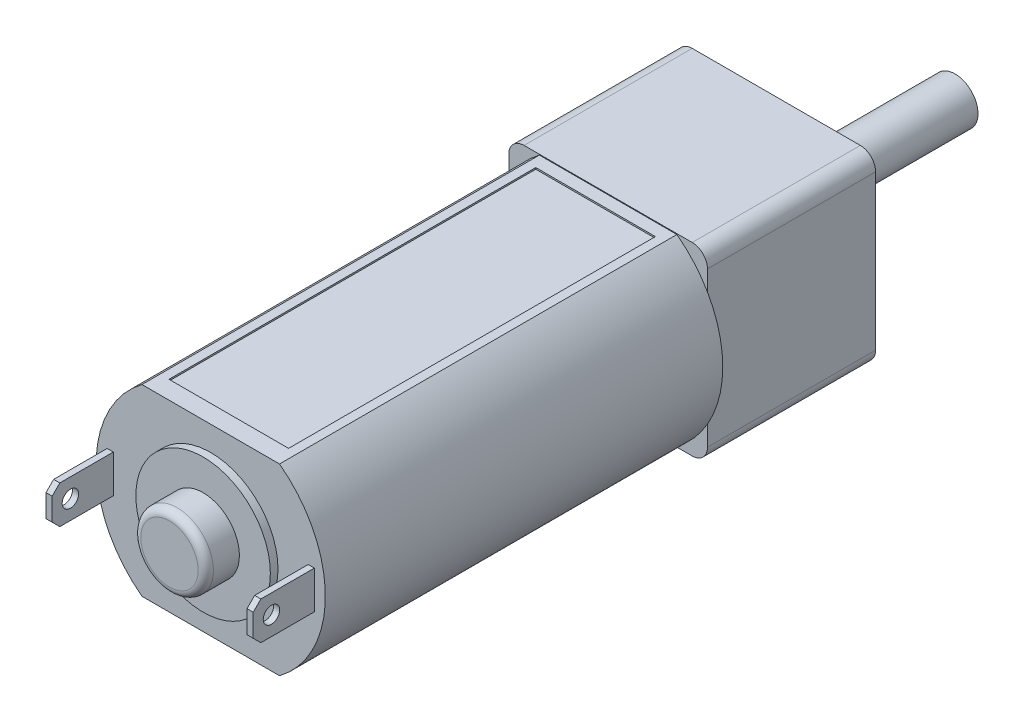
from build123d import *

# Parameters (mm, degrees)
CROQUIS1_W                        = 13
CROQUIS1_H                        = 12.1
SALIENTE_EXTRUIR1_DEPTH           = 11
SALIENTE_EXTRUIR2_DEPTH           = 26
CROQUIS3_R                        = 1.6
SALIENTE_EXTRUIR3_DEPTH           = 0.2
CROQUIS4_R                        = 1.5
SALIENTE_EXTRUIR4_DEPTH           = 11.5
CORTAR_EXTRUIR1_START             = -10
CORTAR_EXTRUIR1_DEPTH             = 10
CROQUIS6_W                        = 0.404320018
CROQUIS6_H                        = 2.479368964
SALIENTE_EXTRUIR5_DEPTH           = 4
CROQUIS7_W                        = 0.404320018
CROQUIS7_H                        = 2.479368964
SALIENTE_EXTRUIR6_DEPTH           = 4
CROQUIS8_W                        = 7.825868338
CROQUIS8_H                        = 23.999330497
CORTAR_EXTRUIR2_DEPTH             = 0.1
CROQUIS10_W                       = 1.15
CROQUIS10_H                       = 0.1
CROQUIS11_W                       = 1.15
CROQUIS11_H                       = 0.1
TALADRO1_D                        = 1.077216746
TALADRO1_DEPTH                    = 1.125812406
TALADRO2_D                        = 1.077216746
TALADRO2_DEPTH                    = 1.125812406
DI_METRO_DE_TALADRO_2_0_2_1_D     = 2
DI_METRO_DE_TALADRO_2_0_2_1_DEPTH = 5
DI_METRO_DE_TALADRO_2_0_2_1_TIP   = 0.600860619
CHAFL_N1_SIZE                     = 0.5
REDONDEO1_R                       = 0.5
REDONDEO2_R                       = 1


with BuildPart() as part:
    # Croquis1 → Saliente-Extruir1 (new body)
    with BuildSketch(Plane.XY):
        Rectangle(CROQUIS1_W, CROQUIS1_H)
    extrude(amount=-SALIENTE_EXTRUIR1_DEPTH)

    # Croquis2 → Saliente-Extruir2 (add)
    with BuildSketch(Plane.XY):
        with BuildLine():
            Line((-4.5, 6), (4.5, 6))
            ThreePointArc((4.5, 6), (7.5, 0), (4.5, -6))
            Line((4.5, -6), (-4.5, -6))
            ThreePointArc((-4.5, -6), (-7.5, 0), (-4.5, 6))
        make_face()
    extrude(amount=SALIENTE_EXTRUIR2_DEPTH)

    # Croquis3 → Saliente-Extruir3 (add)
    with BuildSketch(Plane(origin=(0, 0, -11), x_dir=(-1, 0, 0), z_dir=(0, 0, -1))):
        Circle(CROQUIS3_R)
    extrude(amount=SALIENTE_EXTRUIR3_DEPTH)

    # Croquis4 → Saliente-Extruir4 (add)
    with BuildSketch(Plane(origin=(0, 0, -11.2), x_dir=(-1, 0, 0), z_dir=(0, 0, -1))):
        Circle(CROQUIS4_R)
    extrude(amount=SALIENTE_EXTRUIR4_DEPTH)

    # Croquis5 → Cortar-Extruir1 (cut)
    with BuildSketch(Plane(origin=(0, 0, -22.7), x_dir=(-1, 0, 0), z_dir=(0, 0, -1)).offset(CORTAR_EXTRUIR1_START)):
        with BuildLine():
            Line((1.072168527, -1.049025571), (-1.072168527, -1.049025571))
            ThreePointArc((-1.072168527, -1.049025571), (0, -1.5), (1.072168527, -1.049025571))
        make_face()
    extrude(amount=CORTAR_EXTRUIR1_DEPTH, mode=Mode.SUBTRACT)

    # Croquis6 → Saliente-Extruir5 (add)
    with BuildSketch(Plane.XY.offset(26)):
        with Locations((-6.576347603, 0)):
            Rectangle(CROQUIS6_W, CROQUIS6_H)
    extrude(amount=SALIENTE_EXTRUIR5_DEPTH)

    # Croquis7 → Saliente-Extruir6 (add)
    with BuildSketch(Plane.XY.offset(26)):
        with Locations((6.576347603, 0)):
            Rectangle(CROQUIS7_W, CROQUIS7_H)
    extrude(amount=SALIENTE_EXTRUIR6_DEPTH)

    # Croquis8 → Cortar-Extruir2 (cut)
    with BuildSketch(Plane(origin=(0, 6, 0), x_dir=(-1, 0, 0), z_dir=(0, 1, 0))):
        with Locations((0, 12.819518154)):
            Rectangle(CROQUIS8_W, CROQUIS8_H)
    extrude(amount=-CORTAR_EXTRUIR2_DEPTH, mode=Mode.SUBTRACT)

    # Croquis9 → Revolución1 (revolve)
    with BuildSketch(Plane(origin=(0, 0, 0), x_dir=(1, 0, 0), z_dir=(0, 1, 0))):
        Polygon((4.4, -26), (0, -26), (0, -28.7), (2.375, -28.7), (2.375, -26.5), (4.4, -26.5), align=None)
    revolve(axis=Axis((0, 0, 26), (0, 0, 1)))

    # Croquis10 → Cortar-Revolución1 (revolve, cut)
    with BuildSketch(Plane(origin=(0, -4.05, 0), x_dir=(1, 0, 0), z_dir=(0, 1, 0))):
        with Locations((-3.925, 10.95)):
            Rectangle(CROQUIS10_W, CROQUIS10_H)
    revolve(axis=Axis((-4.5, -4.05, -11), (0, 0, 1)), mode=Mode.SUBTRACT)

    # Croquis11 → Cortar-Revolución2 (revolve, cut)
    with BuildSketch(Plane(origin=(0, 4.05, 0), x_dir=(1, 0, 0), z_dir=(0, 1, 0))):
        with Locations((5.075, 10.95)):
            Rectangle(CROQUIS11_W, CROQUIS11_H)
    revolve(axis=Axis((4.5, 4.05, -11), (0, 0, 1)), mode=Mode.SUBTRACT)

    # Taladro1
    with Locations(Plane(origin=(-6.374187594, 0, 0), x_dir=(0, 0, -1), z_dir=(1, 0, 0))):
        with Locations((-28.806812644, 0)):
            Hole(TALADRO1_D / 2, depth=TALADRO1_DEPTH)

    # Taladro2
    with Locations(Plane.ZY.offset(-6.374187594)):
        with Locations((28.806812644, 0)):
            Hole(TALADRO2_D / 2, depth=TALADRO2_DEPTH)

    # Diámetro de taladro Ø2.0 (2)1
    with Locations(Plane(origin=(0, 0, -11), x_dir=(-1, 0, 0), z_dir=(0, 0, -1))):
        with Locations((0, 4.375), (0, -4.375)):
            Hole(DI_METRO_DE_TALADRO_2_0_2_1_D / 2, depth=DI_METRO_DE_TALADRO_2_0_2_1_DEPTH)
            with Locations((0, 0, -(DI_METRO_DE_TALADRO_2_0_2_1_DEPTH + DI_METRO_DE_TALADRO_2_0_2_1_TIP / 2))):  # 118° drill point
                Cone(0, DI_METRO_DE_TALADRO_2_0_2_1_D / 2, DI_METRO_DE_TALADRO_2_0_2_1_TIP, mode=Mode.SUBTRACT)

    # Chaflán1
    chafl_n1_edges = [part.edges().sort_by_distance(p)[0] for p in [
        (-6.576347603, -1.239684482, 30),
        (-6.576347603, 1.239684482, 30),
        (6.576347603, 1.239684482, 30),
        (6.576347603, -1.239684482, 30),
    ]]
    chamfer(chafl_n1_edges, length=CHAFL_N1_SIZE)

    # Redondeo1
    redondeo1_edges = [part.edges().sort_by_distance(p)[0] for p in [
        (-2.375, 0, 28.7),
    ]]
    fillet(redondeo1_edges, radius=REDONDEO1_R)

    # Redondeo2
    redondeo2_edges = [part.edges().sort_by_distance(p)[0] for p in [
        (-6.5, -6.05, -5.5),
        (-6.5, 6.05, -5.5),
        (6.5, 6.05, -5.5),
        (6.5, -6.05, -5.5),
    ]]
    fillet(redondeo2_edges, radius=REDONDEO2_R)


solid = part.part
